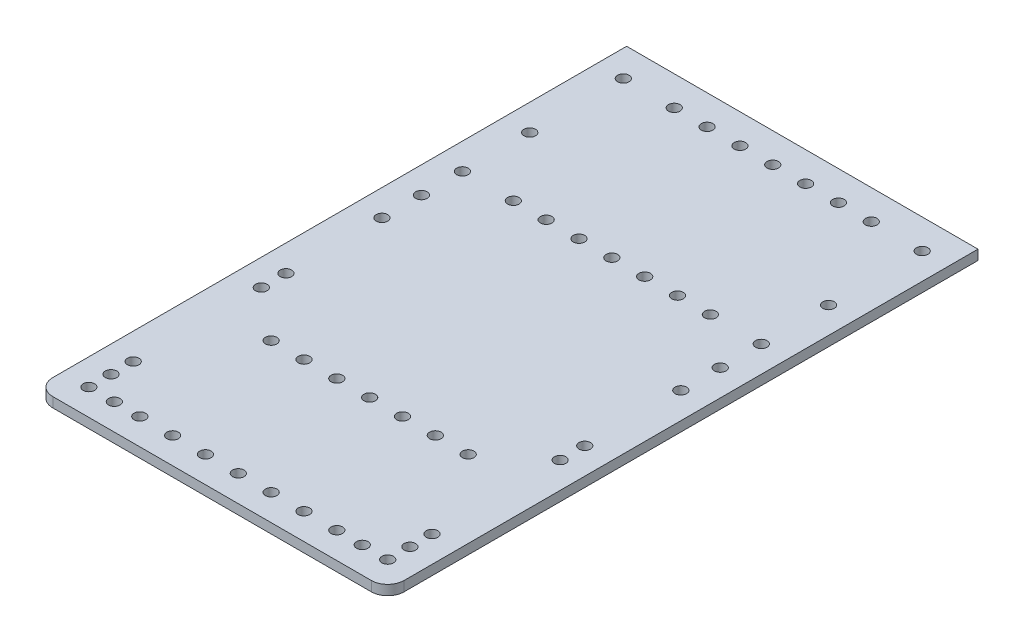
from build123d import *

# Parameters (mm, degrees)
SKETCH1_W           = 107
SKETCH1_H           = 179.75
SKETCH1_R           = 1.75
BOSS_EXTRUDE1_DEPTH = 3
FILLET1_R           = 5


with BuildPart() as part:
    # Sketch1 → Boss-Extrude1 (new body)
    with BuildSketch(Plane(origin=(0, 0, 0), x_dir=(1, 0, 0), z_dir=(0, 1, 0))):
        with Locations((12.634153991, 52.353571429)):
            Rectangle(SKETCH1_W, SKETCH1_H)
        with Locations(Location((-32.865846009, -22.771428571, 0), (0, 0, 270))):
            Circle(SKETCH1_R, mode=Mode.SUBTRACT)
        with Locations(Location((-32.865846009, 59.728571429, 0), (0, 0, 270))):
            Circle(SKETCH1_R, mode=Mode.SUBTRACT)
        with Locations(Location((-32.865846009, -29.521428571, 0), (0, 0, 270))):
            Circle(SKETCH1_R, mode=Mode.SUBTRACT)
        with Locations(Location((-32.865846009, -16.021428571, 0), (0, 0, 270))):
            Circle(SKETCH1_R, mode=Mode.SUBTRACT)
        with Locations(Location((-32.865846009, 22.978571429, 0), (0, 0, 270))):
            Circle(SKETCH1_R, mode=Mode.SUBTRACT)
        with Locations(Location((-32.865846009, 30.478571429, 0), (0, 0, 270))):
            Circle(SKETCH1_R, mode=Mode.SUBTRACT)
        with Locations(Location((-32.865846009, 71.728571429, 0), (0, 0, 270))):
            Circle(SKETCH1_R, mode=Mode.SUBTRACT)
        with Locations(Location((-32.865846009, 84.228571429, 0), (0, 0, 270))):
            Circle(SKETCH1_R, mode=Mode.SUBTRACT)
        with Locations(Location((-32.865846009, 104.728571429, 0), (0, 0, 270))):
            Circle(SKETCH1_R, mode=Mode.SUBTRACT)
        with Locations(Location((12.634153991, 84.228571429, 0), (0, 0, 270))):
            Circle(SKETCH1_R, mode=Mode.SUBTRACT)
        with Locations(Location((2.634153991, 84.228571429, 0), (0, 0, 270))):
            Circle(SKETCH1_R, mode=Mode.SUBTRACT)
        with Locations(Location((-7.365846009, 84.228571429, 0), (0, 0, 270))):
            Circle(SKETCH1_R, mode=Mode.SUBTRACT)
        with Locations(Location((-17.365846009, 84.228571429, 0), (0, 0, 270))):
            Circle(SKETCH1_R, mode=Mode.SUBTRACT)
        with Locations(Location((-25.115846009, -29.521428571, 0), (0, 0, 270))):
            Circle(SKETCH1_R, mode=Mode.SUBTRACT)
        with Locations(Location((-17.365846009, -29.521428571, 0), (0, 0, 270))):
            Circle(SKETCH1_R, mode=Mode.SUBTRACT)
        with Locations(Location((-7.365846009, -29.521428571, 0), (0, 0, 270))):
            Circle(SKETCH1_R, mode=Mode.SUBTRACT)
        with Locations(Location((2.634153991, -29.521428571, 0), (0, 0, 270))):
            Circle(SKETCH1_R, mode=Mode.SUBTRACT)
        with Locations(Location((12.634153991, -29.521428571, 0), (0, 0, 270))):
            Circle(SKETCH1_R, mode=Mode.SUBTRACT)
        with Locations(Location((-17.365846009, 10.478571429, 0), (0, 0, 270))):
            Circle(SKETCH1_R, mode=Mode.SUBTRACT)
        with Locations(Location((-7.365846009, 10.478571429, 0), (0, 0, 270))):
            Circle(SKETCH1_R, mode=Mode.SUBTRACT)
        with Locations(Location((2.634153991, 10.478571429, 0), (0, 0, 270))):
            Circle(SKETCH1_R, mode=Mode.SUBTRACT)
        with Locations(Location((12.634153991, 10.478571429, 0), (0, 0, 270))):
            Circle(SKETCH1_R, mode=Mode.SUBTRACT)
        with Locations(Location((2.634153991, 133.228571429, 0), (0, 0, 270))):
            Circle(SKETCH1_R, mode=Mode.SUBTRACT)
        with Locations(Location((-7.365846009, 133.228571429, 0), (0, 0, 270))):
            Circle(SKETCH1_R, mode=Mode.SUBTRACT)
        with Locations(Location((12.634153991, 133.228571429, 0), (0, 0, 270))):
            Circle(SKETCH1_R, mode=Mode.SUBTRACT)
        with Locations(Location((-32.865846009, 133.228571429, 0), (0, 0, 270))):
            Circle(SKETCH1_R, mode=Mode.SUBTRACT)
        with Locations(Location((-17.365846009, 133.228571429, 0), (0, 0, 270))):
            Circle(SKETCH1_R, mode=Mode.SUBTRACT)
        with Locations(Location((42.634153991, 133.228571429, 0), (0, 0, 270))):
            Circle(SKETCH1_R, mode=Mode.SUBTRACT)
        with Locations(Location((58.134153991, 133.228571429, 0), (0, 0, 270))):
            Circle(SKETCH1_R, mode=Mode.SUBTRACT)
        with Locations(Location((32.634153991, 133.228571429, 0), (0, 0, 270))):
            Circle(SKETCH1_R, mode=Mode.SUBTRACT)
        with Locations(Location((22.634153991, 133.228571429, 0), (0, 0, 270))):
            Circle(SKETCH1_R, mode=Mode.SUBTRACT)
        with Locations(Location((22.634153991, 10.478571429, 0), (0, 0, 270))):
            Circle(SKETCH1_R, mode=Mode.SUBTRACT)
        with Locations(Location((32.634153991, 10.478571429, 0), (0, 0, 270))):
            Circle(SKETCH1_R, mode=Mode.SUBTRACT)
        with Locations(Location((42.634153991, 10.478571429, 0), (0, 0, 270))):
            Circle(SKETCH1_R, mode=Mode.SUBTRACT)
        with Locations(Location((22.634153991, -29.521428571, 0), (0, 0, 270))):
            Circle(SKETCH1_R, mode=Mode.SUBTRACT)
        with Locations(Location((32.634153991, -29.521428571, 0), (0, 0, 270))):
            Circle(SKETCH1_R, mode=Mode.SUBTRACT)
        with Locations(Location((42.634153991, -29.521428571, 0), (0, 0, 270))):
            Circle(SKETCH1_R, mode=Mode.SUBTRACT)
        with Locations(Location((50.384153991, -29.521428571, 0), (0, 0, 270))):
            Circle(SKETCH1_R, mode=Mode.SUBTRACT)
        with Locations(Location((42.634153991, 84.228571429, 0), (0, 0, 270))):
            Circle(SKETCH1_R, mode=Mode.SUBTRACT)
        with Locations(Location((32.634153991, 84.228571429, 0), (0, 0, 270))):
            Circle(SKETCH1_R, mode=Mode.SUBTRACT)
        with Locations(Location((22.634153991, 84.228571429, 0), (0, 0, 270))):
            Circle(SKETCH1_R, mode=Mode.SUBTRACT)
        with Locations(Location((58.134153991, 104.728571429, 0), (0, 0, 270))):
            Circle(SKETCH1_R, mode=Mode.SUBTRACT)
        with Locations(Location((58.134153991, 84.228571429, 0), (0, 0, 270))):
            Circle(SKETCH1_R, mode=Mode.SUBTRACT)
        with Locations(Location((58.134153991, 71.728571429, 0), (0, 0, 270))):
            Circle(SKETCH1_R, mode=Mode.SUBTRACT)
        with Locations(Location((58.134153991, 30.478571429, 0), (0, 0, 270))):
            Circle(SKETCH1_R, mode=Mode.SUBTRACT)
        with Locations(Location((58.134153991, 22.978571429, 0), (0, 0, 270))):
            Circle(SKETCH1_R, mode=Mode.SUBTRACT)
        with Locations(Location((58.134153991, -16.021428571, 0), (0, 0, 270))):
            Circle(SKETCH1_R, mode=Mode.SUBTRACT)
        with Locations(Location((58.134153991, -29.521428571, 0), (0, 0, 270))):
            Circle(SKETCH1_R, mode=Mode.SUBTRACT)
        with Locations(Location((58.134153991, 59.728571429, 0), (0, 0, 270))):
            Circle(SKETCH1_R, mode=Mode.SUBTRACT)
        with Locations(Location((58.134153991, -22.771428571, 0), (0, 0, 270))):
            Circle(SKETCH1_R, mode=Mode.SUBTRACT)
    extrude(amount=BOSS_EXTRUDE1_DEPTH)

    # Fillet1
    fillet1_edges = [part.edges().sort_by_distance(p)[0] for p in [
        (66.134153991, 1.5, 37.521428571),
        (-40.865846009, 1.5, 37.521428571),
    ]]
    fillet(fillet1_edges, radius=FILLET1_R)


solid = part.part
